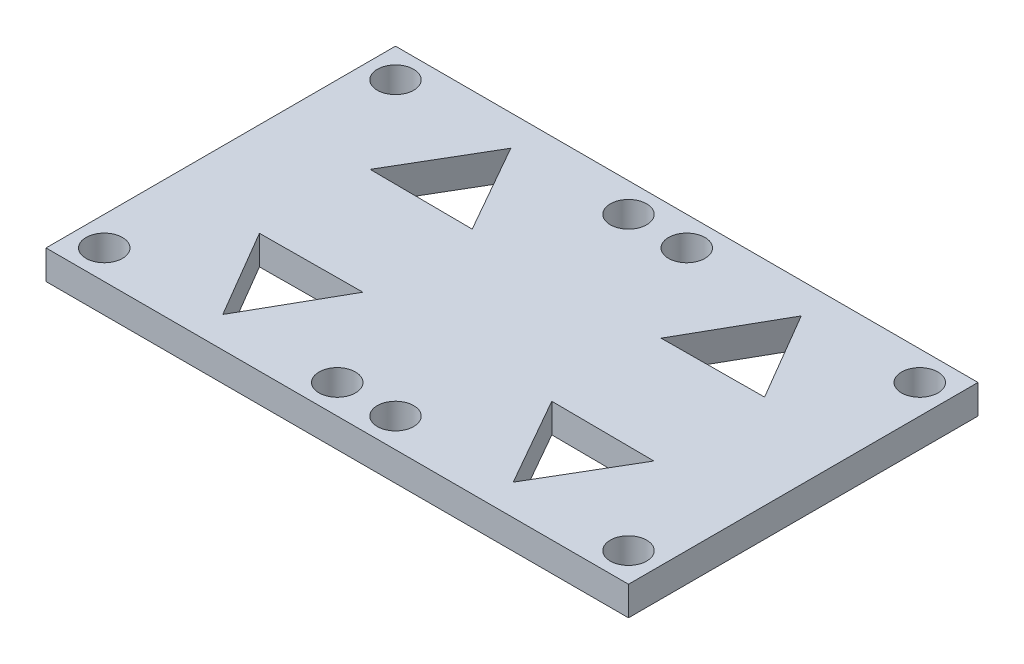
from build123d import *

# Parameters (mm, degrees)
SKETCH1_W           = 127
SKETCH1_H           = 152.4
SKETCH1_R           = 15.875
BOSS_EXTRUDE1_DEPTH = 25.4
CUT_EXTRUDE1_DEPTH  = 25.4


with BuildPart() as part:
    # Sketch1 → Boss-Extrude1 (new body)
    with BuildSketch(Plane(origin=(0, 0, 0), x_dir=(1, 0, 0), z_dir=(0, 1, 0))):
        with Locations((63.5, 76.2)):
            Rectangle(SKETCH1_W, SKETCH1_H)
        with Locations(Location((101.6, 127, 0), (0, 0, 270))):
            Circle(SKETCH1_R, mode=Mode.SUBTRACT)
    boss_extrude1 = extrude(amount=BOSS_EXTRUDE1_DEPTH)

    # Mirror1: Boss-Extrude1 across plane
    add(boss_extrude1.mirror(Plane(origin=(0, 25.4, 0), x_dir=(1, 0, 0), z_dir=(0, 0, -1))))

    # Mirror2: part across plane


with BuildPart() as part_1:
    add(part.part)
    add(part.part.mirror(Plane(origin=(0, 25.4, -152.4), x_dir=(0, 0, 1), z_dir=(1, 0, 0))))

    # Sketch2 → Cut-Extrude1 (cut)
    with BuildSketch(Plane(origin=(0, 25.4, 0), x_dir=(1, 0, 0), z_dir=(0, 1, 0))):
        Polygon((44.642701317, 47.647498522), (0.35523126, 125.58620398), (-44.997932577, 48.262777112), align=None)
    cut_extrude1 = extrude(amount=-CUT_EXTRUDE1_DEPTH, mode=Mode.SUBTRACT)

    # Mirror3: Cut-Extrude1 across plane
    add(cut_extrude1.mirror(Plane.XY), mode=Mode.SUBTRACT)

    # Mirror4: part across plane


with BuildPart() as part_2:
    add(part_1.part)
    add(part_1.part.mirror(Plane(origin=(127, 25.4, -152.4), x_dir=(0, 0, 1), z_dir=(-1, 0, 0))))


solid = part_2.part
